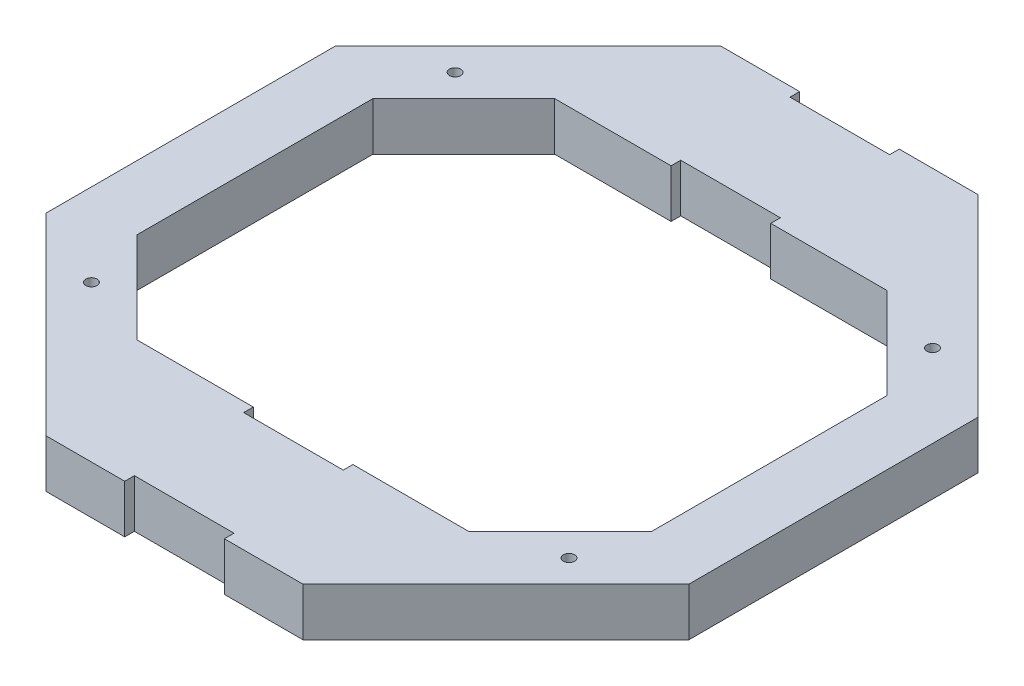
from build123d import *

# Parameters (mm, degrees)
EXTRUDE_15_DEPTH         = 15
CUT_EXTRUDE_1_DEPTH      = 146.773797371
CUT_EXTRUDE_1_DEPTH_BACK = 146.773797371
SKETCH_2_R               = 1.75
SKETCH_2_W               = 31
SKETCH_2_H               = 3


with BuildPart() as part:
    # 草图1 → 15台 (new body)
    with BuildSketch(Plane(origin=(0, 0, 0), x_dir=(1, 0, 0), z_dir=(0, 1, 0))):
        Polygon((40, 105), (100, 45), (100, -45), (40, -105), (-40, -105), (-100, -45), (-100, 45), (-40, 105), align=None)
        Polygon((-80, -36.715728753), (-80, 36.715728753), (-51.715728753, 65), (51.715728753, 65), (80, 36.715728753), (80, -36.715728753), (51.715728753, -65), (-51.715728753, -65), align=None, mode=Mode.SUBTRACT)
    extrude(amount=EXTRUDE_15_DEPTH)

    # 草图2 → 切除-拉伸1 (cut, two sides: drawn at the far end of the back side and taken through both)
    with BuildSketch(Plane(origin=(0, 15, 0), x_dir=(1, 0, 0), z_dir=(0, 1, 0)).offset(-CUT_EXTRUDE_1_DEPTH_BACK)):
        with Locations(Location((-74.289321881, -56.568542495, 0), (0, 0, 270))):
            Circle(SKETCH_2_R)
        with Locations(Location((74.289321881, 56.568542495, 0), (0, 0, 270))):
            Circle(SKETCH_2_R)
        with Locations(Location((-74.289321881, 56.568542495, 0), (0, 0, 270))):
            Circle(SKETCH_2_R)
        with Locations(Location((74.289321881, -56.568542495, 0), (0, 0, 270))):
            Circle(SKETCH_2_R)
        with Locations((0, 103.5)):
            Rectangle(SKETCH_2_W, SKETCH_2_H)
        with Locations((0, 66.5)):
            Rectangle(SKETCH_2_W, SKETCH_2_H)
        with Locations((0, -66.5)):
            Rectangle(SKETCH_2_W, SKETCH_2_H)
        with Locations((0, -103.5)):
            Rectangle(SKETCH_2_W, SKETCH_2_H)
    extrude(amount=CUT_EXTRUDE_1_DEPTH + CUT_EXTRUDE_1_DEPTH_BACK, mode=Mode.SUBTRACT)


solid = part.part
